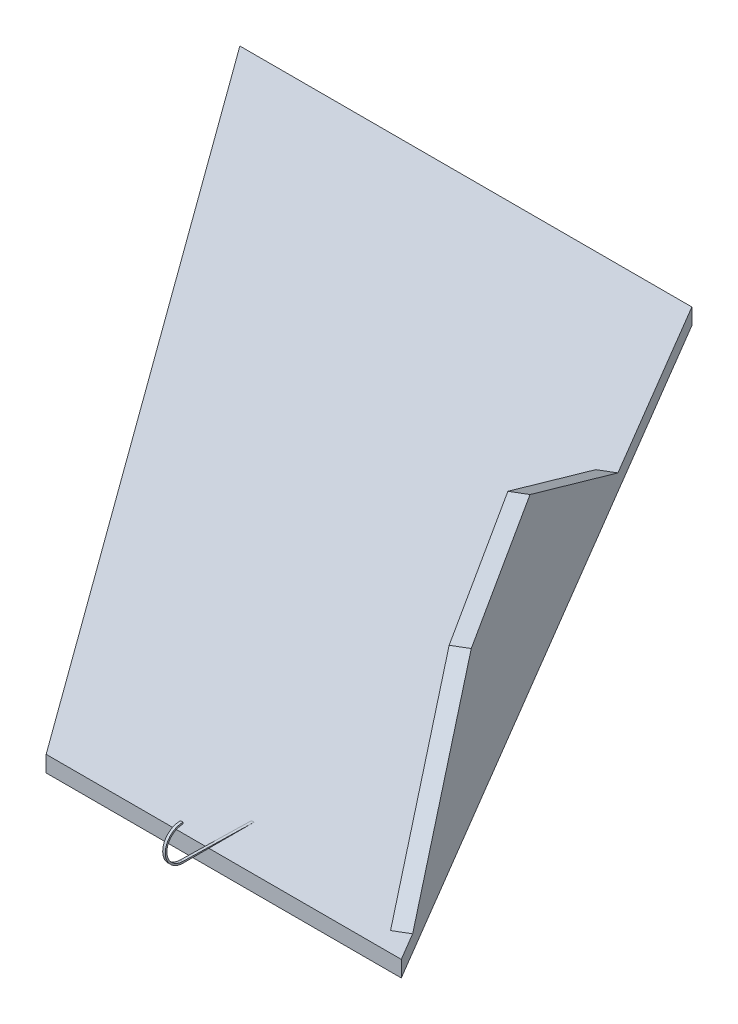
from build123d import *

# Parameters (mm, degrees)
SKETCH_W            = 533.4
SKETCH_H            = 279.4
EXTRUDE_2_DEPTH     = 6.35
EXTRUDE4_DEPTH      = 0.508
EXTRUDE4_DEPTH_BACK = 0.508
EXTRUDE5_DEPTH      = 76.2
EXTRUDE6_DEPTH      = 6.35
CUT_EXTRUDE1_DEPTH  = 23.368


with BuildPart() as part:
    # Sketch → Extrude 2 (new body)
    with BuildSketch(Plane(origin=(0, 0, 0), x_dir=(1, 0, 0), z_dir=(0, 1, 0))):
        with Locations((266.7, 139.7)):
            Rectangle(SKETCH_W, SKETCH_H)
    extrude(amount=EXTRUDE_2_DEPTH)

    # Sketch5 → Extrude4 (add, two sides: drawn at the far end of the back side and taken through both)
    with BuildSketch(Plane.ZY.offset(-266.7).offset(-EXTRUDE4_DEPTH_BACK)):
        with BuildLine():
            Line((0, 6.35), (10.16, 6.35))
            ThreePointArc((10.16, 6.35), (17.145, 13.335), (10.16, 20.32))
            Line((10.16, 20.32), (10.16, 19.685))
            ThreePointArc((10.16, 19.685), (16.509592253, 13.406959845), (10.303910448, 6.986630935))
            Line((10.303910448, 6.986630935), (-17.78, 6.35))
            Line((-17.78, 6.35), (0, 6.35))
        make_face()
    extrude(amount=EXTRUDE4_DEPTH + EXTRUDE4_DEPTH_BACK)

    # Sketch6 → Extrude5 (cut)
    with BuildSketch(Plane.XZ):
        Polygon((185.553034717, -266.27947971), (177.8, -279.4), (185.42, -279.4), (533.4, -279.4), (533.4, 0), (342.9, 0), align=None)
        Polygon((0, 0), (203.2, 0), (0, -279.4), align=None)
    extrude(amount=-EXTRUDE5_DEPTH, mode=Mode.SUBTRACT)

    # Sketch7 → Extrude6 (add)
    with BuildSketch(Plane(origin=(254.155589587, 0, -150.182848392), x_dir=(-0.5087293121266415, 0, -0.8609265282143153), z_dir=(0.8609265282143153, 0, -0.5087293121266415))):
        Polygon((-161.743281128, 6.35), (-62.577151256, 85.691531912), (67.540800287, 6.35), align=None)
    extrude(amount=-EXTRUDE6_DEPTH)

    # Sketch8 → Cut-Extrude1 (cut)
    with BuildSketch(Plane(origin=(254.155589587, 0, -150.182848392), x_dir=(-0.5087293121266415, 0, -0.8609265282143153), z_dir=(0.8609265282143153, 0, -0.5087293121266415))):
        Polygon((-96.293635413, 58.715411062), (-30.684203238, 66.244289445), (-62.577151256, 85.691531912), align=None)
    extrude(amount=-CUT_EXTRUDE1_DEPTH, mode=Mode.SUBTRACT)


solid = part.part
